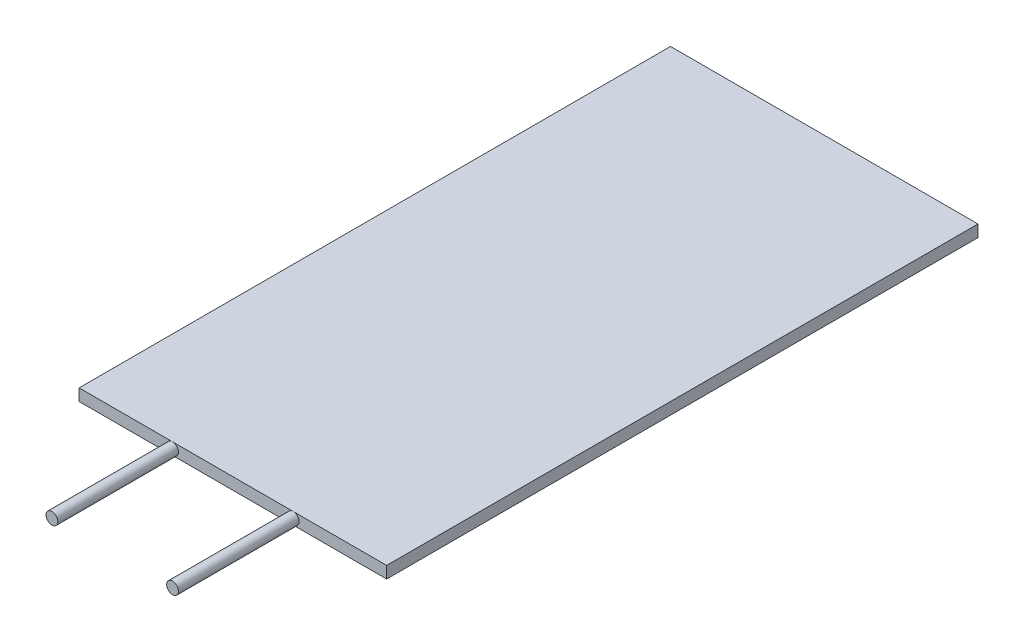
from build123d import *

# Parameters (mm, degrees)
SKETCH1_W           = 13
SKETCH1_H           = 25
BOSS_EXTRUDE1_DEPTH = 0.5
SKETCH2_R           = 0.25
BOSS_EXTRUDE2_DEPTH = 5.1


with BuildPart() as part:
    # Sketch1 → Boss-Extrude1 (new body)
    with BuildSketch(Plane(origin=(0, 0, 0), x_dir=(1, 0, 0), z_dir=(0, 1, 0))):
        Rectangle(SKETCH1_W, SKETCH1_H)
    extrude(amount=BOSS_EXTRUDE1_DEPTH)

    # Sketch2 → Boss-Extrude2 (add)
    with BuildSketch(Plane.XY.offset(12.5)):
        with Locations(Location((-2.55, 0.25, 0), (0, 0, 270))):
            Circle(SKETCH2_R)
        with Locations(Location((2.55, 0.25, 0), (0, 0, 270))):
            Circle(SKETCH2_R)
    extrude(amount=BOSS_EXTRUDE2_DEPTH)


solid = part.part
